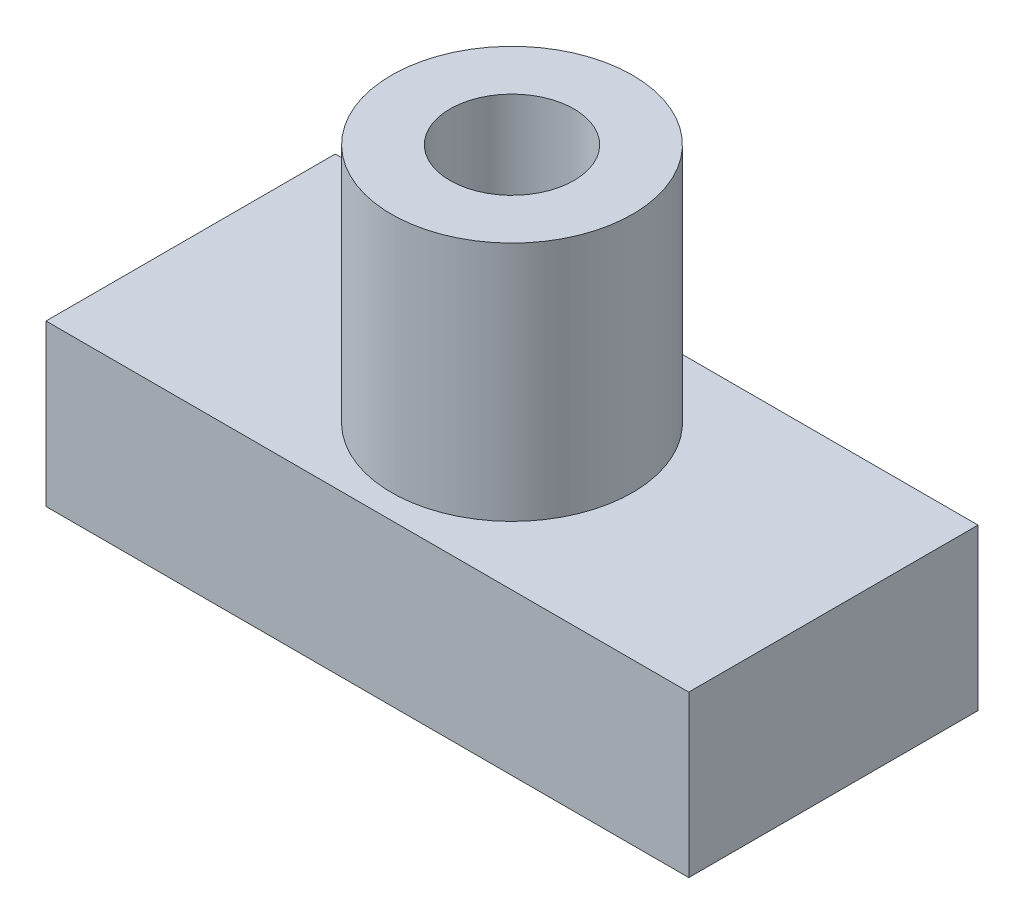
from build123d import *

# Parameters (mm, degrees)
SKETCH1_W                      = 25.4
SKETCH1_H                      = 11.43
BOSS_EXTRUDE1_DEPTH            = 6.35
SKETCH2_R                      = 4.7625
BOSS_EXTRUDE2_DEPTH            = 9.525
SKETCH3_R                      = 2.4511
CUT_EXTRUDE1_DEPTH             = 33.059640126
F_60_0_04_DIAMETER_HOLE1_D     = 2.8448
F_60_0_04_DIAMETER_HOLE1_DEPTH = 3.96875
F_60_0_04_DIAMETER_HOLE1_TIP   = 0.854664145


with BuildPart() as part:
    # Sketch1 → Boss-Extrude1 (new body)
    with BuildSketch(Plane(origin=(0, 0, 0), x_dir=(1, 0, 0), z_dir=(0, 1, 0))):
        with Locations((12.7, 5.715)):
            Rectangle(SKETCH1_W, SKETCH1_H)
    extrude(amount=BOSS_EXTRUDE1_DEPTH)

    # Sketch2 → Boss-Extrude2 (add)
    with BuildSketch(Plane(origin=(0, 6.35, 0), x_dir=(1, 0, 0), z_dir=(0, 1, 0))):
        with Locations(Location((12.7, 5.715, 0), (0, 0, 90))):
            Circle(SKETCH2_R)
    extrude(amount=BOSS_EXTRUDE2_DEPTH)

    # Sketch3 → Cut-Extrude1 (cut, through all)
    with BuildSketch(Plane(origin=(0, 15.875, 0), x_dir=(1, 0, 0), z_dir=(0, 1, 0))):
        with Locations(Location((12.7, 5.715, 0), (0, 0, 270))):
            Circle(SKETCH3_R)
    extrude(amount=-CUT_EXTRUDE1_DEPTH, mode=Mode.SUBTRACT)

    # #60 (0.04) Diameter Hole1
    with Locations(Plane(origin=(8.89, 0, -1.905), x_dir=(0, 0, -1), z_dir=(0, -1, 0))):
        with Locations((0, 0), (7.62, 0), (7.62, 7.62), (0, 7.62)):
            Hole(F_60_0_04_DIAMETER_HOLE1_D / 2, depth=F_60_0_04_DIAMETER_HOLE1_DEPTH)
            with Locations((0, 0, -(F_60_0_04_DIAMETER_HOLE1_DEPTH + F_60_0_04_DIAMETER_HOLE1_TIP / 2))):  # 118° drill point
                Cone(0, F_60_0_04_DIAMETER_HOLE1_D / 2, F_60_0_04_DIAMETER_HOLE1_TIP, mode=Mode.SUBTRACT)


solid = part.part
